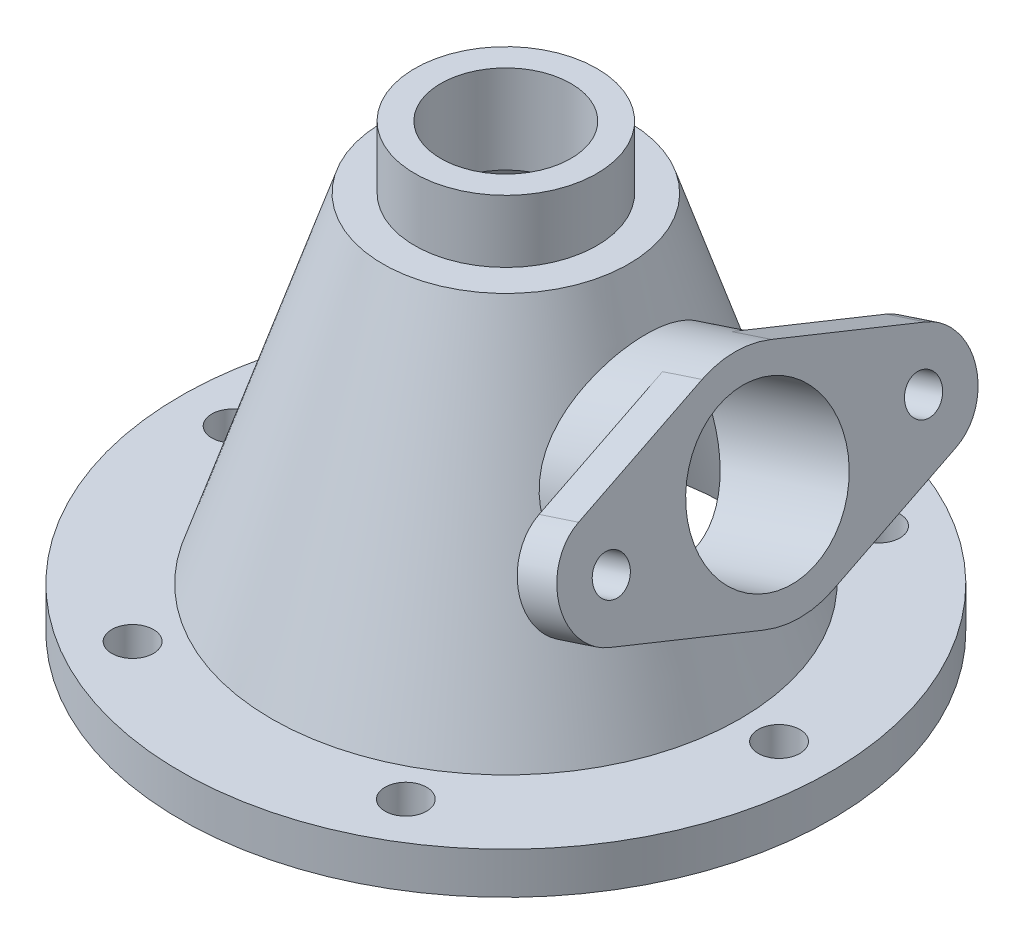
from build123d import *
from build123d.topology import SkipClean

# Parameters (mm, degrees)
SKETCH_11_R         = 4
CUT_EXTRUDE_1_DEPTH = 10
EXTRUDE_1_REACH     = 140.176
SKETCH_13_R         = 20
SKETCH_16_R         = 3.5
EXTRUDE_4_DEPTH     = 8
CUT_EXTRUDE_2_REACH = 140.176
SKETCH_17_R         = 15


with BuildPart() as part:
    # 草图1 → 旋转5 (revolve)
    with BuildSketch(Plane.XY, mode=Mode.PRIVATE) as revolve_5_sk:
        Polygon((42.367967, 0), (62.5, 0), (62.5, 8), (45, 8), (23.618855, 73), (17.5, 73), (17.5, 85), (12.5, 85), (12.5, 68), (20, 68), align=None)
    revolve(revolve_5_sk.sketch.rotate(Axis((0, 0, 0), (0, 1, 0)), 90), axis=Axis((0, 0, 0), (0, 1, 0)))

    # 草图11 → 切除-拉伸1 (cut)
    with BuildSketch(Plane(origin=(0, 8, 0), x_dir=(1, 0, 0), z_dir=(0, 1, 0))):
        with Locations(Location((52.5, 0, 0), (0, 0, 270))):
            Circle(SKETCH_11_R)
        with Locations(Location((26.25, -45.466334, 0), (0, 0, 270))):
            Circle(SKETCH_11_R)
        with Locations(Location((-26.25, -45.466334, 0), (0, 0, 270))):
            Circle(SKETCH_11_R)
        with Locations(Location((-52.5, 0, 0), (0, 0, 270))):
            Circle(SKETCH_11_R)
        with Locations(Location((-26.25, 45.466334, 0), (0, 0, 270))):
            Circle(SKETCH_11_R)
        with Locations(Location((26.25, 45.466334, 0), (0, 0, 270))):
            Circle(SKETCH_11_R)
    extrude(amount=-CUT_EXTRUDE_1_DEPTH, mode=Mode.SUBTRACT)

    # 草图13 → 凸台-拉伸1 (add, up to next)
    with BuildSketch(Plane(origin=(50.133302, 50, 0), x_dir=(0, 0, -1), z_dir=(0.9499276731466783, 0.3124698638111166, 0)), mode=Mode.PRIVATE) as extrude_1_sk1:
        with Locations(Location((0, -0.423678, 0), (0, 0, 90))):
            Circle(SKETCH_13_R)
    extrude_1_tool1 = extrude(extrude_1_sk1.sketch, amount=-EXTRUDE_1_REACH, mode=Mode.PRIVATE) - part.part
    add(extrude_1_tool1.solids().sort_by_distance((50.265689, 49.597537, 0))[0])

    # 草图16 → 凸台-拉伸4 (add)
    with SkipClean():  # the faces are left unmerged after this step: merging them gives an invalid solid
        with BuildSketch(Plane(origin=(50.133302, 50, 0), x_dir=(0, 0, -1), z_dir=(0.9499276731466783, 0.3124698638111166, 0))):
            with BuildLine():
                Line((-33.333333, 9.010442), (-6.662877, 18.433842))
                ThreePointArc((-6.662877, 18.433842), (0, 19.576322), (6.662877, 18.433842))
                Line((6.662877, 18.433842), (33.333333, 9.010442))
                ThreePointArc((33.333333, 9.010442), (40.001895, -0.416533), (33.336702, -9.845889))
                Line((33.336702, -9.845889), (6.669613, -19.278817))
                ThreePointArc((6.669613, -19.278817), (0, -20.423678), (-6.669613, -19.278817))
                Line((-6.669613, -19.278817), (-33.336702, -9.845889))
                ThreePointArc((-33.336702, -9.845889), (-40.001895, -0.416533), (-33.333333, 9.010442))
            make_face()
            with Locations(Location((30.001895, -0.418319, 0), (0, 0, 90))):
                Circle(SKETCH_16_R, mode=Mode.SUBTRACT)
            with Locations(Location((-30.001895, -0.418319, 0), (0, 0, 270))):
                Circle(SKETCH_16_R, mode=Mode.SUBTRACT)
        extrude(amount=-EXTRUDE_4_DEPTH)

    # 草图17 → 切除-拉伸2 (cut, up to next)
    with BuildSketch(Plane(origin=(50.133302, 50, 0), x_dir=(0, 0, -1), z_dir=(0.9499276731466783, 0.3124698638111166, 0)), mode=Mode.PRIVATE) as cut_extrude_2_sk1:
        with Locations(Location((0, -0.418319, 0), (0, 0, 90))):
            Circle(SKETCH_17_R)
    cut_extrude_2_tool1 = extrude(cut_extrude_2_sk1.sketch, amount=-CUT_EXTRUDE_2_REACH, mode=Mode.PRIVATE) & part.part
    add(cut_extrude_2_tool1.solids().sort_by_distance((50.264014, 49.602627, 0))[0], mode=Mode.SUBTRACT)


solid = part.part
